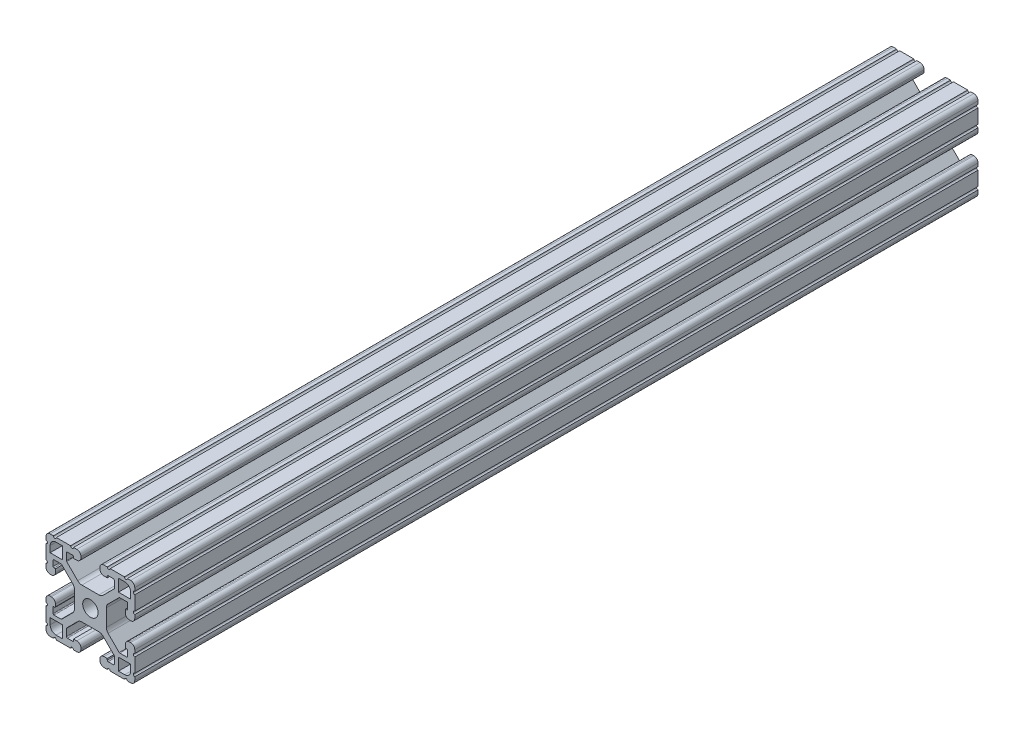
from build123d import *

# Parameters (mm, degrees)
BOSS_EXTRUDE1_DEPTH      = 180.975
BOSS_EXTRUDE1_DEPTH_BACK = 180.975
SKETCH3_W                = 38.1
SKETCH3_H                = 38.1
SKETCH4_W                = 5.207
SKETCH4_H                = 5.207
SKETCH4_R                = 3.302
CUT_EXTRUDE1_DEPTH       = 363.951246726
CUT_EXTRUDE2_DEPTH       = 363.951246726
FILLET1_R                = 2.54
FILLET2_R                = 1.778
FILLET3_R                = 0.396875


with BuildPart() as part:
    # Sketch3 → Boss-Extrude1 (new, two sides: drawn at the far end of the back side and taken through both)
    with BuildSketch(Plane.XY.offset(-BOSS_EXTRUDE1_DEPTH_BACK)):
        Rectangle(SKETCH3_W, SKETCH3_H)
    extrude(amount=BOSS_EXTRUDE1_DEPTH + BOSS_EXTRUDE1_DEPTH_BACK)

    # Sketch4 → Cut-Extrude1 (cut, through all)
    with BuildSketch(Plane.XY.offset(180.975)):
        Polygon((7.239, 14.986), (4.064, 14.986), (4.064, 19.05), (-4.064, 19.05), (-4.064, 14.986), (-7.239, 14.986), (-7.239, 16.002), (-10.287, 16.002), (-10.287, 12.442261469), (-4.702738531, 6.858), (4.702738531, 6.858), (10.287, 12.442261469), (10.287, 16.002), (7.239, 16.002), align=None)
        Polygon((10.287, -12.442261469), (4.702738531, -6.858), (-4.702738531, -6.858), (-10.287, -12.442261469), (-10.287, -16.002), (-7.239, -16.002), (-7.239, -14.986), (-4.064, -14.986), (-4.064, -19.05), (4.064, -19.05), (4.064, -14.986), (7.239, -14.986), (7.239, -16.002), (10.287, -16.002), align=None)
        Polygon((-12.442261469, -10.287), (-6.858, -4.702738531), (-6.858, 4.702738531), (-12.442261469, 10.287), (-16.002, 10.287), (-16.002, 7.239), (-14.986, 7.239), (-14.986, 4.064), (-19.05, 4.064), (-19.05, -4.064), (-14.986, -4.064), (-14.986, -7.239), (-16.002, -7.239), (-16.002, -10.287), align=None)
        Polygon((14.986, -7.239), (14.986, -4.064), (19.05, -4.064), (19.05, 4.064), (14.986, 4.064), (14.986, 7.239), (16.002, 7.239), (16.002, 10.287), (12.442261469, 10.287), (6.858, 4.702738531), (6.858, -4.702738531), (12.442261469, -10.287), (16.002, -10.287), (16.002, -7.239), align=None)
        with Locations((14.6685, 14.6685)):
            Rectangle(SKETCH4_W, SKETCH4_H)
        with Locations((14.6685, -14.6685)):
            Rectangle(SKETCH4_W, SKETCH4_H)
        with Locations((-14.6685, 14.6685)):
            Rectangle(SKETCH4_W, SKETCH4_H)
        with Locations((-14.6685, -14.6685)):
            Rectangle(SKETCH4_W, SKETCH4_H)
        Circle(SKETCH4_R)
    extrude(amount=-CUT_EXTRUDE1_DEPTH, mode=Mode.SUBTRACT)

    # Sketch5 → Cut-Extrude2 (cut, through all)
    with BuildSketch(Plane.XY.offset(180.975)):
        with BuildLine():
            Line((-14.605, 19.05), (-15.875, 19.05))
            ThreePointArc((-15.875, 19.05), (-15.24, 18.415), (-14.605, 19.05))
        make_face()
        with BuildLine():
            Line((-7.239, 19.05), (-8.509, 19.05))
            ThreePointArc((-8.509, 19.05), (-7.874, 18.415), (-7.239, 19.05))
        make_face()
        with BuildLine():
            ThreePointArc((-19.05, 14.605), (-18.415, 15.24), (-19.05, 15.875))
            Line((-19.05, 15.875), (-19.05, 14.605))
        make_face()
        with BuildLine():
            ThreePointArc((-19.05, 7.239), (-18.415, 7.874), (-19.05, 8.509))
            Line((-19.05, 8.509), (-19.05, 7.239))
        make_face()
        with BuildLine():
            ThreePointArc((7.239, 19.05), (7.874, 18.415), (8.509, 19.05))
            Line((8.509, 19.05), (7.239, 19.05))
        make_face()
        with BuildLine():
            ThreePointArc((14.605, 19.05), (15.24, 18.415), (15.875, 19.05))
            Line((15.875, 19.05), (14.605, 19.05))
        make_face()
        with BuildLine():
            Line((19.05, 14.605), (19.05, 15.875))
            ThreePointArc((19.05, 15.875), (18.415, 15.24), (19.05, 14.605))
        make_face()
        with BuildLine():
            Line((19.05, 7.239), (19.05, 8.509))
            ThreePointArc((19.05, 8.509), (18.415, 7.874), (19.05, 7.239))
        make_face()
        with BuildLine():
            ThreePointArc((19.05, -7.239), (18.415, -7.874), (19.05, -8.509))
            Line((19.05, -8.509), (19.05, -7.239))
        make_face()
        with BuildLine():
            ThreePointArc((19.05, -14.605), (18.415, -15.24), (19.05, -15.875))
            Line((19.05, -15.875), (19.05, -14.605))
        make_face()
        with BuildLine():
            Line((14.605, -19.05), (15.875, -19.05))
            ThreePointArc((15.875, -19.05), (15.24, -18.415), (14.605, -19.05))
        make_face()
        with BuildLine():
            Line((7.239, -19.05), (8.509, -19.05))
            ThreePointArc((8.509, -19.05), (7.874, -18.415), (7.239, -19.05))
        make_face()
        with BuildLine():
            ThreePointArc((-7.239, -19.05), (-7.874, -18.415), (-8.509, -19.05))
            Line((-8.509, -19.05), (-7.239, -19.05))
        make_face()
        with BuildLine():
            ThreePointArc((-14.605, -19.05), (-15.24, -18.415), (-15.875, -19.05))
            Line((-15.875, -19.05), (-14.605, -19.05))
        make_face()
        with BuildLine():
            Line((-19.05, -14.605), (-19.05, -15.875))
            ThreePointArc((-19.05, -15.875), (-18.415, -15.24), (-19.05, -14.605))
        make_face()
        with BuildLine():
            Line((-19.05, -7.239), (-19.05, -8.509))
            ThreePointArc((-19.05, -8.509), (-18.415, -7.874), (-19.05, -7.239))
        make_face()
    extrude(amount=-CUT_EXTRUDE2_DEPTH, mode=Mode.SUBTRACT)

    # Fillet1
    fillet1_edges = [part.edges().sort_by_distance(p)[0] for p in [
        (6.858, -4.702738531, 0),
        (6.858, 4.702738531, 0),
        (-17.272, 17.272, 0),
        (-17.272, -17.272, 0),
        (17.272, -17.272, 0),
        (17.272, 17.272, 0),
        (-4.702738531, -6.858, 0),
        (4.702738531, -6.858, 0),
        (-6.858, 4.702738531, 0),
        (-6.858, -4.702738531, 0),
        (4.702738531, 6.858, 0),
        (-4.702738531, 6.858, 0),
    ]]
    fillet(fillet1_edges, radius=FILLET1_R)

    # Fillet2
    fillet2_edges = [part.edges().sort_by_distance(p)[0] for p in [
        (14.986, 4.064, 0),
        (19.05, 4.064, 0),
        (19.05, -4.064, 0),
        (14.986, -4.064, 0),
        (4.064, -14.986, 0),
        (4.064, -19.05, 0),
        (-4.064, -19.05, 0),
        (-4.064, -14.986, 0),
        (-14.986, -4.064, 0),
        (-19.05, -4.064, 0),
        (-19.05, 4.064, 0),
        (-14.986, 4.064, 0),
        (-19.05, 19.05, 0),
        (19.05, 19.05, 0),
        (19.05, -19.05, 0),
        (-19.05, -19.05, 0),
        (-4.064, 14.986, 0),
        (-4.064, 19.05, 0),
        (4.064, 19.05, 0),
        (4.064, 14.986, 0),
    ]]
    fillet(fillet2_edges, radius=FILLET2_R)

    # Fillet3
    fillet3_edges = [part.edges().sort_by_distance(p)[0] for p in [
        (12.442261469, 10.287, 0),
        (16.002, 10.287, 0),
        (16.002, 7.239, 0),
        (16.002, -7.239, 0),
        (16.002, -10.287, 0),
        (12.442261469, -10.287, 0),
        (-7.239, -16.002, 0),
        (-10.287, -16.002, 0),
        (-10.287, -12.442261469, 0),
        (10.287, -12.442261469, 0),
        (10.287, -16.002, 0),
        (7.239, -16.002, 0),
        (-16.002, 7.239, 0),
        (-16.002, 10.287, 0),
        (-12.442261469, 10.287, 0),
        (-12.442261469, -10.287, 0),
        (-16.002, -10.287, 0),
        (-14.986, -7.239, 0),
        (-10.287, 12.442261469, 0),
        (-10.287, 16.002, 0),
        (-7.239, 16.002, 0),
        (7.239, 16.002, 0),
        (10.287, 16.002, 0),
        (10.287, 12.442261469, 0),
    ]]
    fillet(fillet3_edges, radius=FILLET3_R)


solid = part.part
